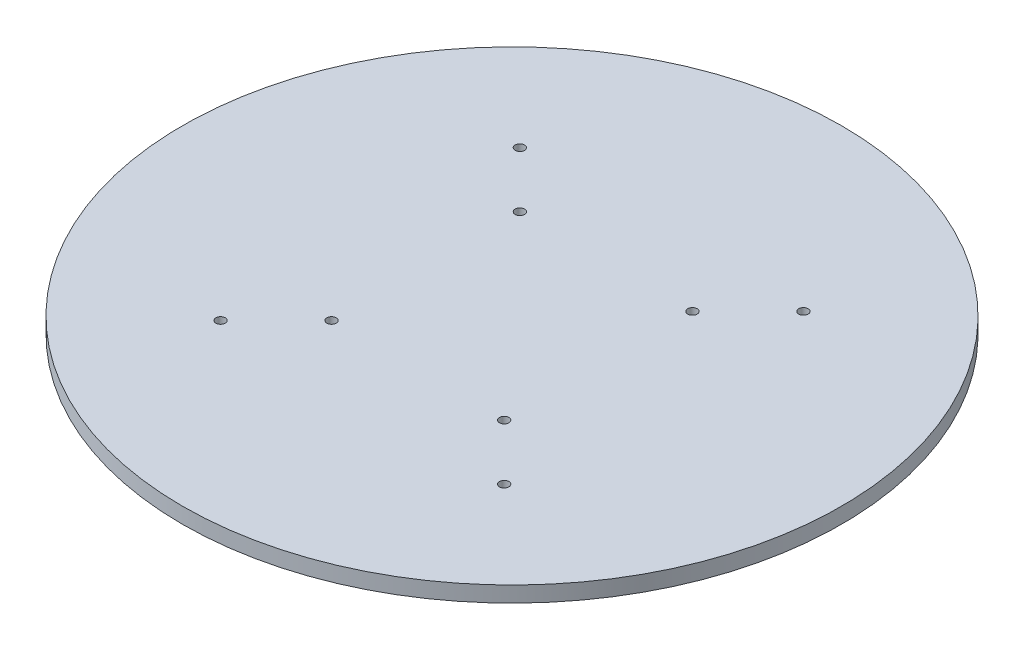
from build123d import *

# Parameters (mm, degrees)
SKETCH1_R           = 105
SKETCH1_R_2         = 1.5
BOSS_EXTRUDE1_DEPTH = 5


with BuildPart() as part:
    # Sketch1 → Boss-Extrude1 (new body)
    with BuildSketch(Plane(origin=(0, 0, 0), x_dir=(1, 0, 0), z_dir=(0, 1, 0))):
        with Locations(Location((0, 0, 0), (0, 0, 270))):
            Circle(SKETCH1_R)
        with Locations(Location((-27.5, 30, 0), (0, 0, 270))):
            Circle(SKETCH1_R_2, mode=Mode.SUBTRACT)
        with Locations(Location((27.5, 30, 0), (0, 0, 90))):
            Circle(SKETCH1_R_2, mode=Mode.SUBTRACT)
        with Locations(Location((27.5, -30, 0), (0, 0, 270))):
            Circle(SKETCH1_R_2, mode=Mode.SUBTRACT)
        with Locations(Location((-27.5, -30, 0), (0, 0, 90))):
            Circle(SKETCH1_R_2, mode=Mode.SUBTRACT)
        with Locations(Location((-45.17766953, 47.67766953, 0), (0, 0, 270))):
            Circle(SKETCH1_R_2, mode=Mode.SUBTRACT)
        with Locations(Location((45.17766953, 47.67766953, 0), (0, 0, 90))):
            Circle(SKETCH1_R_2, mode=Mode.SUBTRACT)
        with Locations(Location((45.17766953, -47.67766953, 0), (0, 0, 270))):
            Circle(SKETCH1_R_2, mode=Mode.SUBTRACT)
        with Locations(Location((-45.17766953, -47.67766953, 0), (0, 0, 90))):
            Circle(SKETCH1_R_2, mode=Mode.SUBTRACT)
    extrude(amount=BOSS_EXTRUDE1_DEPTH)


solid = part.part
